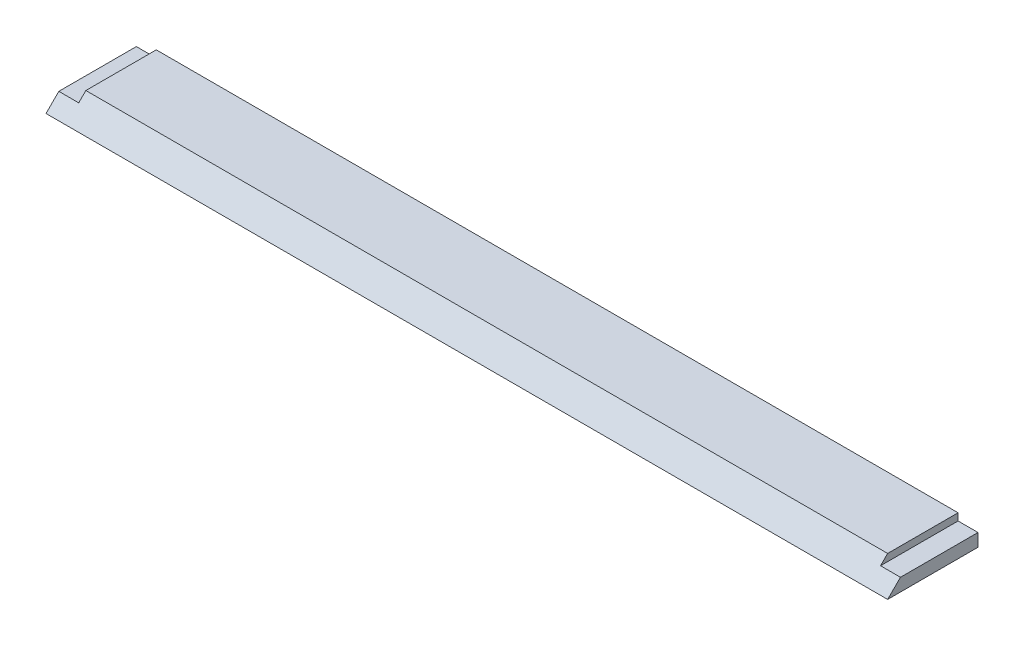
from build123d import *

# Parameters (mm, degrees)
SKETCH_1_W          = 118.3
SKETCH_1_H          = 12.7
EXTRUDE_1_DEPTH     = 2.8
SKETCH_2_W          = 2.8
SKETCH_2_H          = 12.7
CUT_EXTRUDE_1_DEPTH = 1
CUT_EXTRUDE_2_DEPTH = 120.692278835


with BuildPart() as part:
    # 草图1 → 凸台-拉伸1 (new body)
    with BuildSketch(Plane(origin=(0, 0, 0), x_dir=(1, 0, 0), z_dir=(0, 1, 0))):
        with Locations((26.798571429, 11.636428571)):
            Rectangle(SKETCH_1_W, SKETCH_1_H)
    extrude(amount=EXTRUDE_1_DEPTH)

    # 草图2 → 切除-拉伸1 (cut)
    with BuildSketch(Plane(origin=(0, 2.8, 0), x_dir=(1, 0, 0), z_dir=(0, 1, 0))):
        with Locations((-30.951428571, 11.636428571)):
            Rectangle(SKETCH_2_W, SKETCH_2_H)
        with Locations((84.548571429, 11.636428571)):
            Rectangle(SKETCH_2_W, SKETCH_2_H)
    extrude(amount=-CUT_EXTRUDE_1_DEPTH, mode=Mode.SUBTRACT)

    # 草图3 → 切除-拉伸2 (cut, through all)
    with BuildSketch(Plane(origin=(85.948571429, 0, 0), x_dir=(0, 0, -1), z_dir=(1, 0, 0))):
        Polygon((5.286428571, 0), (5.286428571, 2.8), (8.086428571, 2.8), align=None)
    extrude(amount=-CUT_EXTRUDE_2_DEPTH, mode=Mode.SUBTRACT)


solid = part.part
